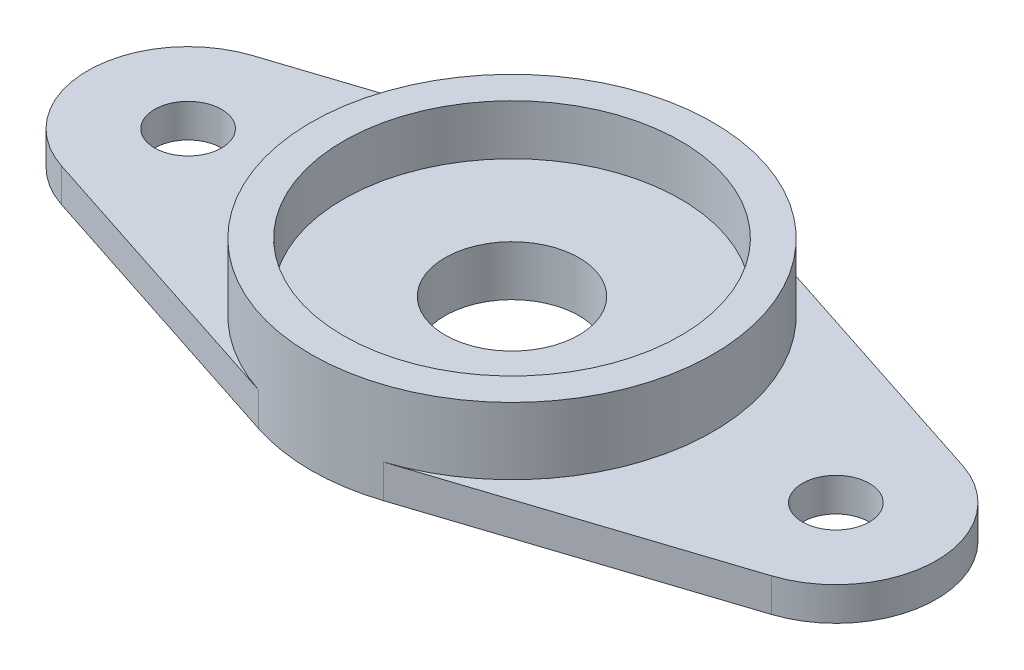
from build123d import *
from build123d.topology import SkipClean

# Parameters (mm, degrees)
SKETCH1_R           = 1.5
SKETCH1_R_2         = 3
BOSS_EXTRUDE1_DEPTH = 4.4972
CUT_EXTRUDE2_START  = 4.4972
SKETCH1_6_R         = 7.55
CUT_EXTRUDE2_DEPTH  = 2.25
CUT_EXTRUDE1_START  = 1.5
SKETCH1_5_R         = 1.5
CUT_EXTRUDE1_DEPTH  = 2.9972


with BuildPart() as part:
    # Sketch1 → Boss-Extrude1 (new body)
    with BuildSketch(Plane(origin=(0, 0, 0), x_dir=(1, 0, 0), z_dir=(0, 1, 0))):
        with BuildLine():
            Line((15.901070321, 4.277965365), (2.792140641, 8.555930729))
            ThreePointArc((2.792140641, 8.555930729), (0, 9), (-2.792140641, 8.555930729))
            Line((-2.792140641, 8.555930729), (-15.901070321, 4.277965365))
            ThreePointArc((-15.901070321, 4.277965365), (-19.005, 0), (-15.901070321, -4.277965365))
            Line((-15.901070321, -4.277965365), (-2.792140641, -8.555930729))
            ThreePointArc((-2.792140641, -8.555930729), (0, -9), (2.792140641, -8.555930729))
            Line((2.792140641, -8.555930729), (15.901070321, -4.277965365))
            ThreePointArc((15.901070321, -4.277965365), (19.005, 0), (15.901070321, 4.277965365))
        make_face()
        with Locations(Location((14.505, 0, 0), (0, 0, 270))):
            Circle(SKETCH1_R, mode=Mode.SUBTRACT)
        with Locations(Location((-14.505, 0, 0), (0, 0, 270))):
            Circle(SKETCH1_R, mode=Mode.SUBTRACT)
        with Locations(Location((0, 0, 0), (0, 0, 270))):
            Circle(SKETCH1_R_2, mode=Mode.SUBTRACT)
    extrude(amount=BOSS_EXTRUDE1_DEPTH)

    # Sketch1<6> → Cut-Extrude2 (cut)
    with BuildSketch(Plane(origin=(0, 0, 0), x_dir=(1, 0, 0), z_dir=(0, 1, 0)).offset(CUT_EXTRUDE2_START)):
        with Locations(Location((0, 0, 0), (0, 0, 270))):
            Circle(SKETCH1_6_R)
    extrude(amount=-CUT_EXTRUDE2_DEPTH, mode=Mode.SUBTRACT)

    # Sketch1<5> → Cut-Extrude1 (cut)
    # profile 1 of 2: a face of its own
    with SkipClean():  # the faces are left unmerged after this step: merging them gives an invalid solid
        with BuildSketch(Plane(origin=(0, 0, 0), x_dir=(1, 0, 0), z_dir=(0, 1, 0)).offset(CUT_EXTRUDE1_START)):
            with BuildLine():
                Line((-15.901070321, -4.277965365), (-2.792140641, -8.555930729))
                ThreePointArc((-2.792140641, -8.555930729), (-9, 0), (-2.792140641, 8.555930729))
                Line((-2.792140641, 8.555930729), (-15.901070321, 4.277965365))
                ThreePointArc((-15.901070321, 4.277965365), (-19.005, 0), (-15.901070321, -4.277965365))
            make_face()
            with Locations(Location((-14.505, 0, 0), (0, 0, 270))):
                Circle(SKETCH1_5_R, mode=Mode.SUBTRACT)
        # profile 2 of 2: a face of its own
        with BuildSketch(Plane(origin=(0, 0, 0), x_dir=(1, 0, 0), z_dir=(0, 1, 0)).offset(CUT_EXTRUDE1_START)):
            with BuildLine():
                ThreePointArc((9, 0), (7.284547542, -5.28539186), (2.792140641, -8.555930729))
                Line((2.792140641, -8.555930729), (15.901070321, -4.277965365))
                ThreePointArc((15.901070321, -4.277965365), (19.005, 0), (15.901070321, 4.277965365))
                Line((15.901070321, 4.277965365), (2.792140641, 8.555930729))
                ThreePointArc((2.792140641, 8.555930729), (7.284547542, 5.28539186), (9, 0))
            make_face()
            with Locations(Location((14.505, 0, 0), (0, 0, 270))):
                Circle(SKETCH1_5_R, mode=Mode.SUBTRACT)
        extrude(amount=CUT_EXTRUDE1_DEPTH, mode=Mode.SUBTRACT)


solid = part.part
